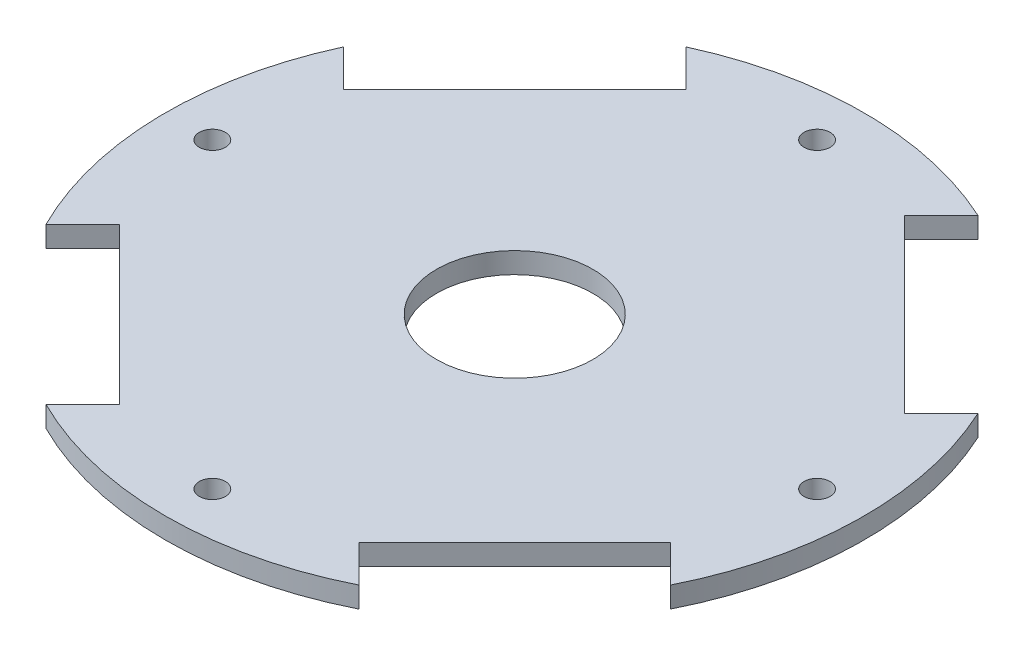
from build123d import *

# Parameters (mm, degrees)
SKETCH1_R           = 67
SKETCH1_R_2         = 2.5
BOSS_EXTRUDE1_DEPTH = 4
SKETCH2_R           = 15
CUT_EXTRUDE1_DEPTH  = 4
CUT_EXTRUDE2_DEPTH  = 10


with BuildPart() as part:
    # Sketch1 → Boss-Extrude1 (new body)
    with BuildSketch(Plane(origin=(0, 0, 0), x_dir=(1, 0, 0), z_dir=(0, 1, 0))):
        with Locations(Location((0, 0, 0), (0, 0, 270))):
            Circle(SKETCH1_R)
        with Locations(Location((-58, 0, 0), (0, 0, 270))):
            Circle(SKETCH1_R_2, mode=Mode.SUBTRACT)
        with Locations(Location((0, -58, 0), (0, 0, 270))):
            Circle(SKETCH1_R_2, mode=Mode.SUBTRACT)
        with Locations(Location((58, 0, 0), (0, 0, 270))):
            Circle(SKETCH1_R_2, mode=Mode.SUBTRACT)
        with Locations(Location((0, 58, 0), (0, 0, 270))):
            Circle(SKETCH1_R_2, mode=Mode.SUBTRACT)
    extrude(amount=BOSS_EXTRUDE1_DEPTH)

    # Sketch2 → Cut-Extrude1 (cut)
    with BuildSketch(Plane(origin=(0, 4, 0), x_dir=(1, 0, 0), z_dir=(0, 1, 0))):
        with Locations(Location((0, 0, 0), (0, 0, 270))):
            Circle(SKETCH2_R)
    extrude(amount=-CUT_EXTRUDE1_DEPTH, mode=Mode.SUBTRACT)

    # Sketch4 → Cut-Extrude2 (cut)
    with BuildSketch(Plane.XZ):
        with BuildLine():
            Line((59.908263203, 30), (52.837195391, 22.928932188))
            Line((52.837195391, 22.928932188), (22.928932188, 52.837195391))
            Line((22.928932188, 52.837195391), (30, 59.908263203))
            ThreePointArc((30, 59.908263203), (47.376154339, 47.376154339), (59.908263203, 30))
        make_face()
        with BuildLine():
            Line((-59.908263203, 30), (-52.837195391, 22.928932188))
            Line((-52.837195391, 22.928932188), (-22.928932188, 52.837195391))
            Line((-22.928932188, 52.837195391), (-30, 59.908263203))
            ThreePointArc((-30, 59.908263203), (-47.376154339, 47.376154339), (-59.908263203, 30))
        make_face()
        with BuildLine():
            Line((-53.797643362, -20.928932188), (-20.928932188, -53.797643362))
            Line((-20.928932188, -53.797643362), (-28, -60.868711174))
            ThreePointArc((-28, -60.868711174), (-47.376154339, -47.376154339), (-60.868711174, -28))
            Line((-60.868711174, -28), (-53.797643362, -20.928932188))
        make_face()
        with BuildLine():
            Line((53.797643362, -20.928932188), (20.928932188, -53.797643362))
            Line((20.928932188, -53.797643362), (28, -60.868711174))
            ThreePointArc((28, -60.868711174), (47.376154339, -47.376154339), (60.868711174, -28))
            Line((60.868711174, -28), (53.797643362, -20.928932188))
        make_face()
    extrude(amount=-CUT_EXTRUDE2_DEPTH, mode=Mode.SUBTRACT)


solid = part.part
